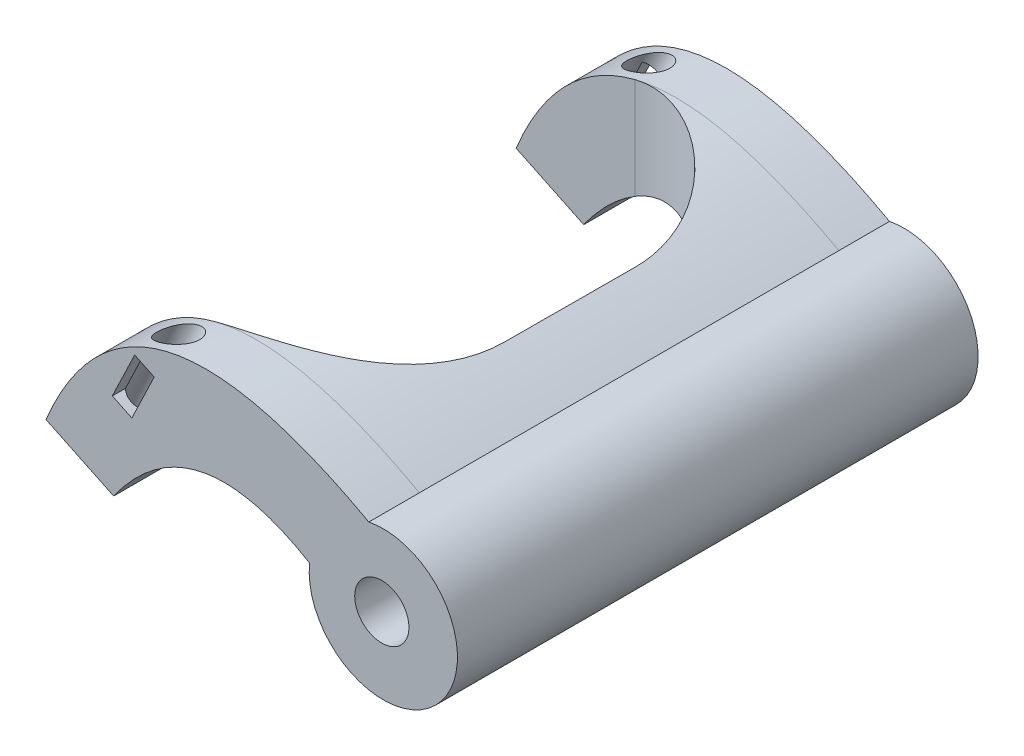
from build123d import *

# Parameters (mm, degrees)
SKETCH1_R                = 10.25
BOSS_EXTRUDE1_DEPTH      = 7
SKETCH2_R                = 3.75
CUT_EXTRUDE1_DEPTH       = 2
BOSS_EXTRUDE3_START      = -7
BOSS_EXTRUDE3_DEPTH      = 7
SKETCH11_R               = 2.25
CUT_EXTRUDE3_DEPTH       = 30
CUT_EXTRUDE4_DEPTH       = 3
SKETCH15_R               = 10.25
BOSS_EXTRUDE4_DEPTH      = 65
BOSS_EXTRUDE5_DEPTH      = 58
CUT_EXTRUDE5_DEPTH       = 44
CUT_EXTRUDE5_DEPTH_BACK  = 34
BOSS_EXTRUDE6_DEPTH      = 15
BOSS_EXTRUDE6_DEPTH_BACK = 20
SKETCH20_R               = 10.25
SKETCH21_R               = 3.75
CUT_EXTRUDE6_DEPTH       = 92


with BuildPart() as part:
    # Sketch1 → Boss-Extrude1 (new body)
    with BuildSketch(Plane.XY):
        Circle(SKETCH1_R)
    extrude(amount=BOSS_EXTRUDE1_DEPTH)

    # Sketch2 → Cut-Extrude1 (cut)
    with BuildSketch(Plane(origin=(0, 0, 0), x_dir=(-1, 0, 0), z_dir=(0, 0, -1))):
        with Locations((0.204827132, 0.201115052)):
            Circle(SKETCH2_R)
    cut_extrude1 = extrude(amount=-CUT_EXTRUDE1_DEPTH, mode=Mode.SUBTRACT)

    # Sketch4 → Boss-Extrude3 (add)
    with BuildSketch(Plane.XY.offset(7).offset(BOSS_EXTRUDE3_START)):
        with BuildLine():
            add(Edge.make_bspline(
                [(-46.64048221, 0), (-34.962013149, 28.10744238), (-2.004119339, 10.052164228)],
                knots=[0, 0, 0, 1, 1, 1], degree=2))
            Line((-46.64048221, 0), (-37.28232369, -4.481971191))
            add(Edge.make_bspline(
                [(-10.196546661, 1.045435881), (-26.46828973, 10.703347347), (-37.28232369, -4.481971191)],
                knots=[0, 0, 0, 1, 1, 1], degree=2))
            ThreePointArc((-10.196546661, 1.045435881), (-7.58250299, 6.896966609), (-2.004119339, 10.052164228))
        make_face()
    boss_extrude3 = extrude(amount=BOSS_EXTRUDE3_DEPTH)

    # Sketch11 → Cut-Extrude3 (cut)
    with BuildSketch(Plane(origin=(-8.702296632, -18.170012234, 0), x_dir=(0, 0, 1), z_dir=(-0.4319519366403788, -0.9018966262452843, 0))):
        with Locations(Location((3.5, 35.498805819, 0), (0, 0, 270))):
            Circle(SKETCH11_R)
    cut_extrude3 = extrude(amount=-CUT_EXTRUDE3_DEPTH, mode=Mode.SUBTRACT)

    # Sketch13 → Cut-Extrude4 (cut)
    with BuildSketch(Plane(origin=(0, 0, 0), x_dir=(-1, 0, 0), z_dir=(0, 0, -1))):
        Polygon((34.379239122, 13.872575937), (31.676706965, 12.578232477), (34.770203183, 6.119148571), (37.47273534, 7.41349203), align=None)
    cut_extrude4 = extrude(amount=-CUT_EXTRUDE4_DEPTH, mode=Mode.SUBTRACT)

    # Sketch15 → Boss-Extrude4 (add)
    with BuildSketch(Plane.XY.offset(7)):
        with Locations(Location((0, 0, 0), (0, 0, 174.146009255))):
            Circle(SKETCH15_R)
    extrude(amount=BOSS_EXTRUDE4_DEPTH)

    # Mirror1: Cut-Extrude1, Boss-Extrude3, Cut-Extrude3, Cut-Extrude4 across plane
    add(cut_extrude1.mirror(Plane.XY.offset(36)), mode=Mode.SUBTRACT)
    add(boss_extrude3.mirror(Plane.XY.offset(36)))
    add(cut_extrude3.mirror(Plane.XY.offset(36)), mode=Mode.SUBTRACT)
    add(cut_extrude4.mirror(Plane.XY.offset(36)), mode=Mode.SUBTRACT)

    # Sketch18 → Boss-Extrude5 (add)
    with BuildSketch(Plane.XY.offset(7)):
        with BuildLine():
            Line((-46.64048221, 0), (-37.28232368, -4.481971176))
            add(Edge.make_bspline(
                [(-37.28232368, -4.481971176), (-26.468289723, 10.703347342), (-10.196546661, 1.045435881)],
                knots=[0, 0, 0, 1, 1, 1], degree=2))
            ThreePointArc((-10.196546661, 1.045435881), (-7.58250299, 6.896966609), (-2.004119339, 10.052164228))
            add(Edge.make_bspline(
                [(-2.004119339, 10.052164228), (-34.962013149, 28.10744238), (-46.64048221, 0)],
                knots=[0, 0, 0, 1, 1, 1], degree=2))
        make_face()
    extrude(amount=BOSS_EXTRUDE5_DEPTH)

    # Sketch19 → Cut-Extrude5 (cut, two sides: drawn at the far end of the back side and taken through both)
    with BuildSketch(Plane(origin=(0, 0, 0), x_dir=(1, 0, 0), z_dir=(0, 1, 0)).offset(-CUT_EXTRUDE5_DEPTH_BACK)):
        with BuildLine():
            Line((-56.84662667, -7), (-30.196546661, -7))
            ThreePointArc((-30.196546661, -7), (-16.054411038, -12.857864376), (-10.196546661, -27))
            Line((-10.196546661, -27), (-10.25, -45))
            ThreePointArc((-10.25, -45), (-16.107864376, -59.142135624), (-30.25, -65))
            Line((-30.25, -65), (-56.84662667, -65))
            Line((-56.84662667, -65), (-56.84662667, -7))
        make_face()
    extrude(amount=CUT_EXTRUDE5_DEPTH + CUT_EXTRUDE5_DEPTH_BACK, mode=Mode.SUBTRACT)

    # Sketch20 → Boss-Extrude6 (add, two sides: drawn at the far end of the back side and taken through both)
    with BuildSketch(Plane.XY.offset(36).offset(-BOSS_EXTRUDE6_DEPTH_BACK)):
        Circle(SKETCH20_R)
    extrude(amount=BOSS_EXTRUDE6_DEPTH + BOSS_EXTRUDE6_DEPTH_BACK)

    # Sketch21 → Cut-Extrude6 (cut)
    with BuildSketch(Plane.XY.offset(70)):
        with Locations(Location((-0.204827132, 0.201115052, 0), (0, 0, 180))):
            Circle(SKETCH21_R)
    extrude(amount=-CUT_EXTRUDE6_DEPTH, mode=Mode.SUBTRACT)


solid = part.part
